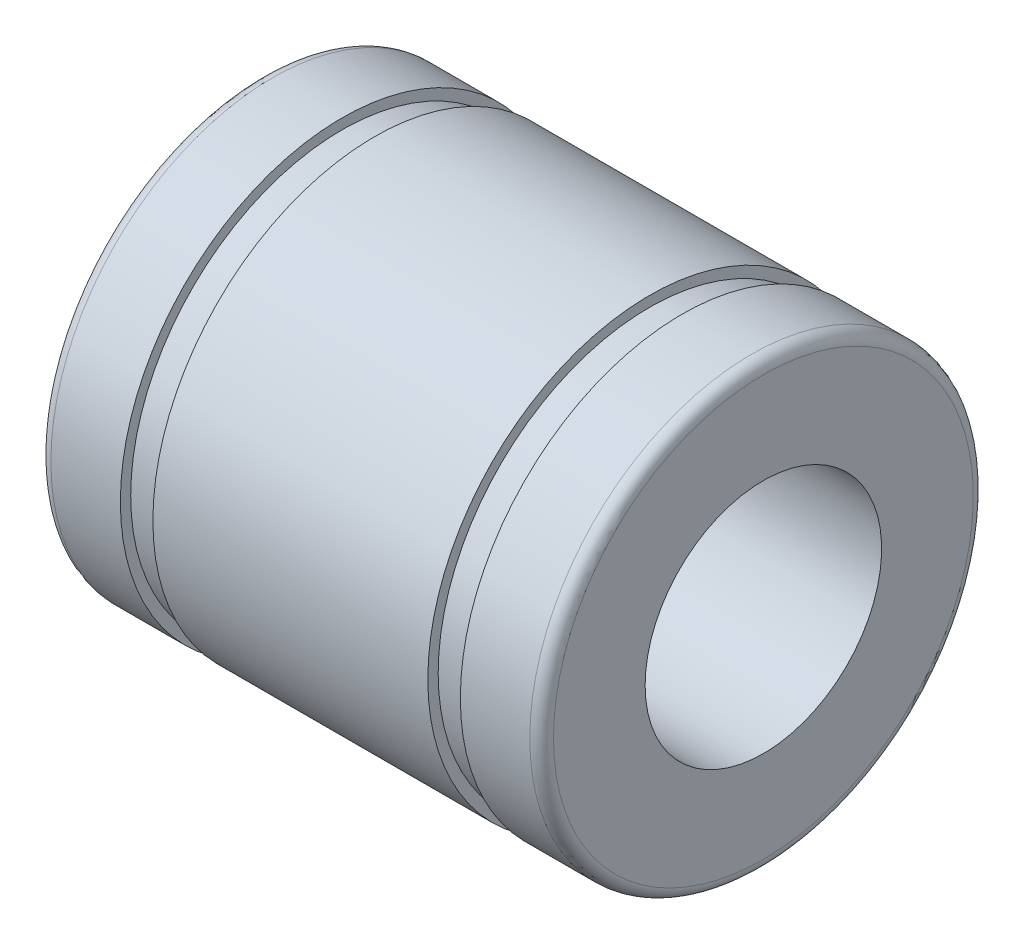
from build123d import *

# Parameters (mm, degrees)
SKETCH_1_W = 17
SKETCH_1_H = 3.5
SKETCH_2_W = 1.1
SKETCH_2_H = 0.35
FILLET_1_R = 0.4


with BuildPart() as part:
    # 草图1 → 旋转1 (revolve)
    with BuildSketch(Plane.XY, mode=Mode.PRIVATE) as revolve_1_sk:
        with Locations((0, 5.75)):
            Rectangle(SKETCH_1_W, SKETCH_1_H)
    revolve(revolve_1_sk.sketch.rotate(Axis((0, 0, 0), (1, 0, 0)), 90), axis=Axis((0, 0, 0), (1, 0, 0)))

    # 草图2 → 切除-旋转1 (revolve, cut)
    with BuildSketch(Plane.XY, mode=Mode.PRIVATE) as cut_revolve_1_sk:
        with Locations((-5.2, 7.325)):
            Rectangle(SKETCH_2_W, SKETCH_2_H)
        with Locations((5.2, 7.325)):
            Rectangle(SKETCH_2_W, SKETCH_2_H)
    revolve(cut_revolve_1_sk.sketch.rotate(Axis((0, 0, 0), (1, 0, 0)), 90), axis=Axis((0, 0, 0), (1, 0, 0)), mode=Mode.SUBTRACT)

    # 圆角1
    fillet_1_edges = [part.edges().sort_by_distance(p)[0] for p in [
        (-8.5, 0, -7.5),
        (8.5, 0, -7.5),
    ]]
    fillet(fillet_1_edges, radius=FILLET_1_R)


solid = part.part
